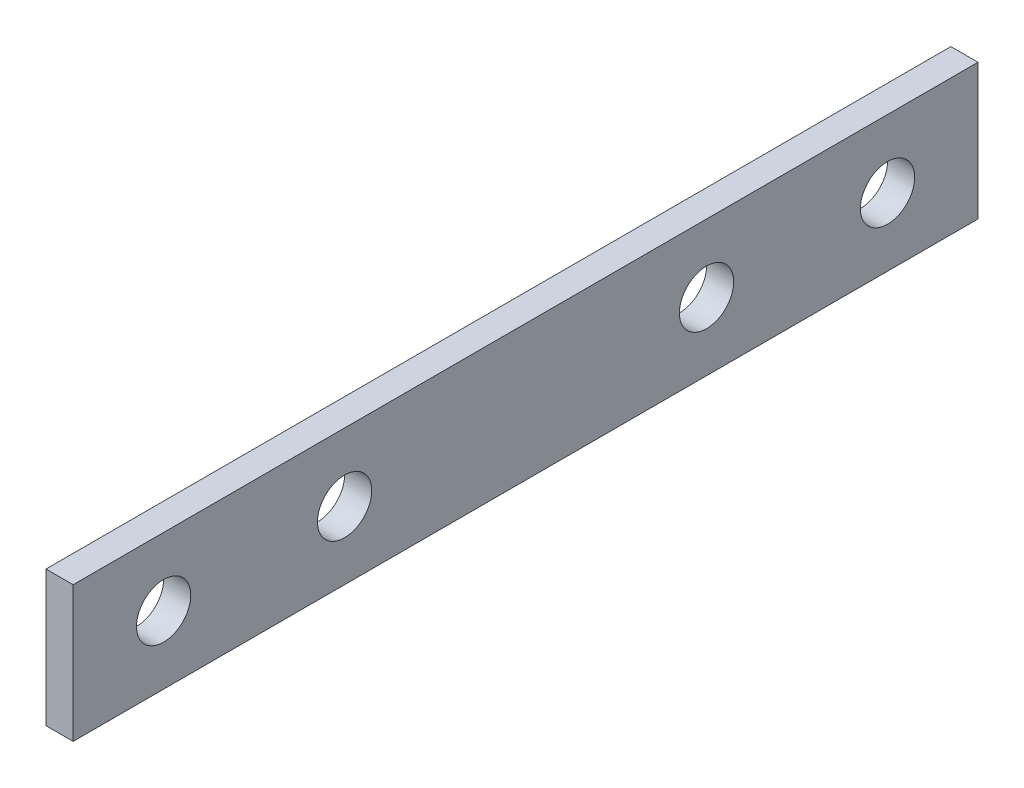
from build123d import *

# Parameters (mm, degrees)
SKETCH_1_W      = 100
SKETCH_1_H      = 15
SKETCH_1_R      = 3
EXTRUDE_1_DEPTH = 3


with BuildPart() as part:
    # Эскиз1 → Бобышка-Вытянуть1 (new body)
    with BuildSketch(Plane(origin=(0, 0, 0), x_dir=(0, 0, -1), z_dir=(1, 0, 0))):
        Rectangle(SKETCH_1_W, SKETCH_1_H)
        with Locations((-40, 0)):
            Circle(SKETCH_1_R, mode=Mode.SUBTRACT)
        with Locations((-20, 0)):
            Circle(SKETCH_1_R, mode=Mode.SUBTRACT)
        with Locations(Location((20, 0, 0), (0, 0, 180))):
            Circle(SKETCH_1_R, mode=Mode.SUBTRACT)
        with Locations(Location((40, 0, 0), (0, 0, 180))):
            Circle(SKETCH_1_R, mode=Mode.SUBTRACT)
    extrude(amount=EXTRUDE_1_DEPTH)


solid = part.part
